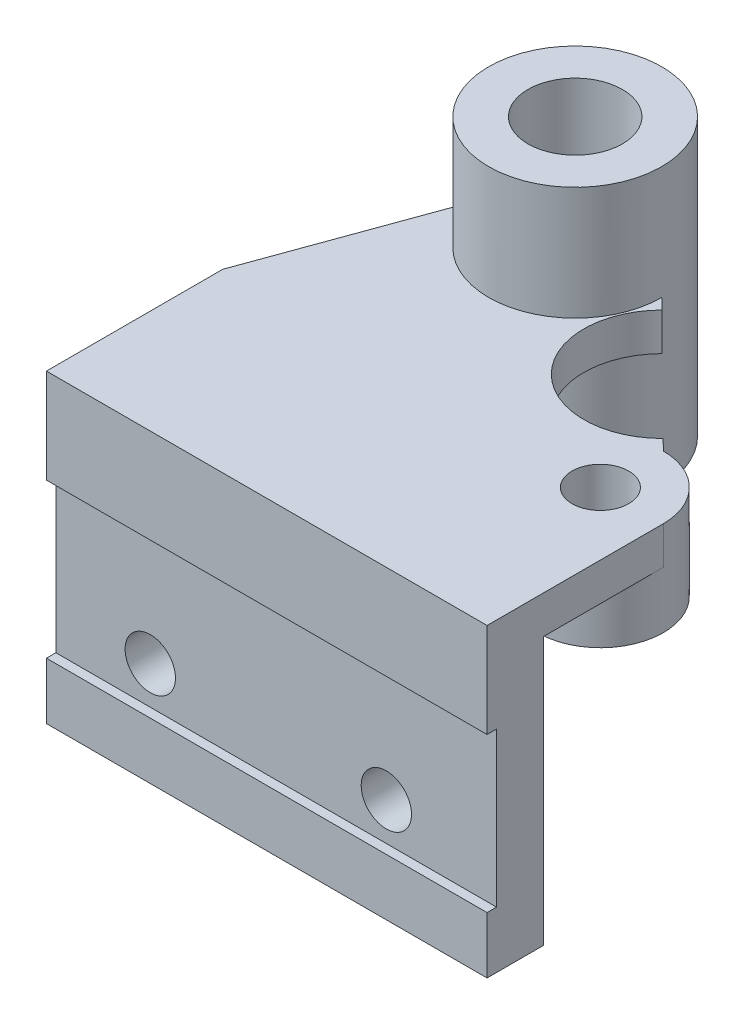
from build123d import *

# Parameters (mm, degrees)
SKETCH1_W                = 140
SKETCH1_H                = 85
BOSS_EXTRUDE1_DEPTH      = 18
SKETCH2_W                = 3
SKETCH2_H                = 49
CUT_EXTRUDE1_DEPTH       = 220
SKETCH3_R                = 8
CUT_EXTRUDE4_DEPTH       = 30
SKETCH5_W                = 56
SKETCH5_H                = 12
BOSS_EXTRUDE2_DEPTH      = 140
BOSS_EXTRUDE3_DEPTH      = 18
BOSS_EXTRUDE3_DEPTH_BACK = 12
SKETCH7_R                = 20
SKETCH8_R                = 9
CUT_EXTRUDE5_DEPTH       = 50
BOSS_EXTRUDE4_DEPTH      = 12
BOSS_EXTRUDE6_DEPTH      = 36
BOSS_EXTRUDE6_DEPTH_BACK = 52
SKETCH11_R               = 27.5
SKETCH12_R               = 15
CUT_EXTRUDE6_DEPTH       = 109
CUT_EXTRUDE11_DEPTH      = 12


with BuildPart() as part:
    # Sketch1 → Boss-Extrude1 (new body)
    with BuildSketch(Plane.XY):
        with Locations((70, -42.5)):
            Rectangle(SKETCH1_W, SKETCH1_H)
    extrude(amount=BOSS_EXTRUDE1_DEPTH)

    # Sketch2 → Cut-Extrude1 (cut)
    with BuildSketch(Plane(origin=(140, 0, 0), x_dir=(0, 0, -1), z_dir=(1, 0, 0))):
        with Locations((-16.5, -42.5)):
            Rectangle(SKETCH2_W, SKETCH2_H)
    extrude(amount=-CUT_EXTRUDE1_DEPTH, mode=Mode.SUBTRACT)

    # Sketch3 → Cut-Extrude4 (cut)
    with BuildSketch(Plane(origin=(0, 0, 0), x_dir=(-1, 0, 0), z_dir=(0, 0, -1))):
        with Locations((-105, -55)):
            Circle(SKETCH3_R)
        with Locations((-30, -55)):
            Circle(SKETCH3_R)
    extrude(amount=-CUT_EXTRUDE4_DEPTH, mode=Mode.SUBTRACT)

    # Sketch5 → Boss-Extrude2 (add)
    with BuildSketch(Plane(origin=(140, 0, 0), x_dir=(0, 0, -1), z_dir=(1, 0, 0))):
        with Locations((10, 6)):
            Rectangle(SKETCH5_W, SKETCH5_H)
    extrude(amount=-BOSS_EXTRUDE2_DEPTH)

    # Sketch7 → Boss-Extrude3 (add, two sides: drawn at the far end of the back side and taken through both)
    with BuildSketch(Plane.XZ.offset(-BOSS_EXTRUDE3_DEPTH_BACK)):
        with Locations(Location((120, -38, 0), (0, 0, 180))):
            Circle(SKETCH7_R)
    extrude(amount=BOSS_EXTRUDE3_DEPTH + BOSS_EXTRUDE3_DEPTH_BACK)

    # Sketch8 → Cut-Extrude5 (cut)
    with BuildSketch(Plane(origin=(0, -18, 0), x_dir=(-1, 0, 0), z_dir=(0, -1, 0))):
        with Locations(Location((-120, 38, 0), (0, 0, 90))):
            Circle(SKETCH8_R)
    extrude(amount=-CUT_EXTRUDE5_DEPTH, mode=Mode.SUBTRACT)

    # Sketch10 → Boss-Extrude4 (add)
    with BuildSketch(Plane.XZ):
        with BuildLine():
            Line((0, -38), (22.5, -100))
            ThreePointArc((22.5, -100), (50, -72.5), (77.5, -100))
            Line((77.5, -100), (120, -58))
            ThreePointArc((120, -58), (105.857864376, -52.142135624), (100, -38))
            Line((100, -38), (0, -38))
        make_face()
    extrude(amount=-BOSS_EXTRUDE4_DEPTH)

    # Sketch11 → Boss-Extrude6 (add, two sides: drawn at the far end of the back side and taken through both)
    with BuildSketch(Plane(origin=(0, 12, 0), x_dir=(1, 0, 0), z_dir=(0, 1, 0)).offset(-BOSS_EXTRUDE6_DEPTH_BACK)):
        with Locations(Location((50, 100, 0), (0, 0, 270))):
            Circle(SKETCH11_R)
    extrude(amount=BOSS_EXTRUDE6_DEPTH + BOSS_EXTRUDE6_DEPTH_BACK)

    # Sketch12 → Cut-Extrude6 (cut)
    with BuildSketch(Plane.XZ.offset(40)):
        with Locations(Location((50, -100, 0), (0, 0, 270))):
            Circle(SKETCH12_R)
    extrude(amount=-CUT_EXTRUDE6_DEPTH, mode=Mode.SUBTRACT)

    # Sketch14 → Cut-Extrude11 (cut)
    with BuildSketch(Plane(origin=(0, 12, 0), x_dir=(1, 0, 0), z_dir=(0, 1, 0))):
        with BuildLine():
            Line((80.968040171, 96.572760302), (116.531959829, 61.427239698))
            ThreePointArc((116.531959829, 61.427239698), (81.177239698, 61.218040171), (80.968040171, 96.572760302))
        make_face()
    extrude(amount=-CUT_EXTRUDE11_DEPTH, mode=Mode.SUBTRACT)


solid = part.part
